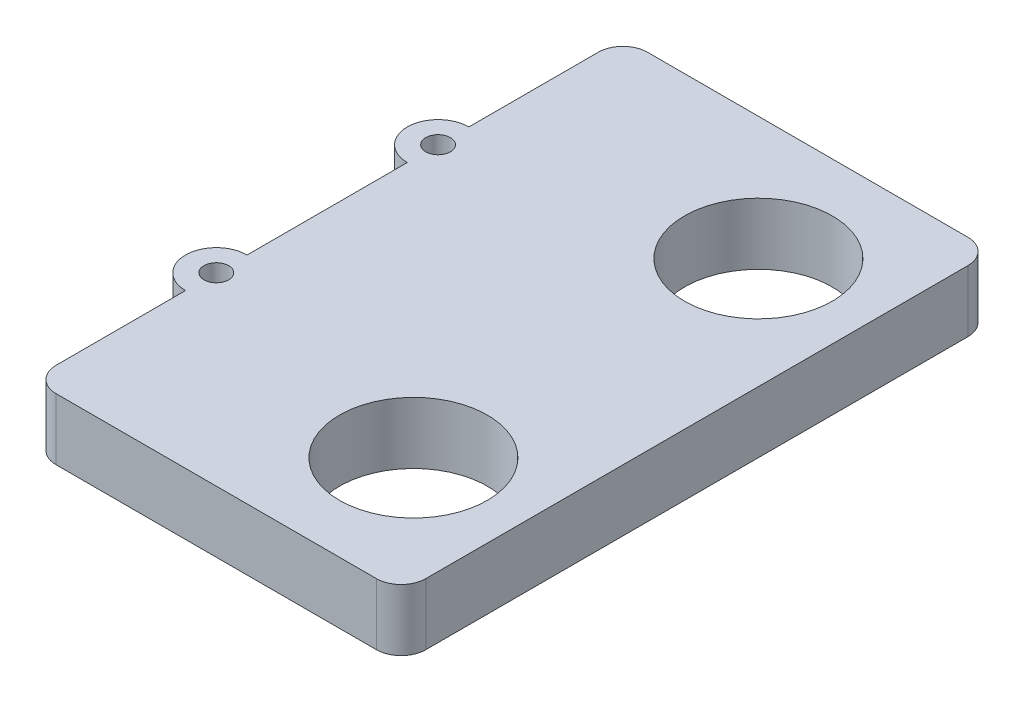
from build123d import *

# Parameters (mm, degrees)
SKETCH1_R           = 6
SKETCH1_R_2         = 1
BOSS_EXTRUDE1_DEPTH = 5
FILLET2_R           = 2


with BuildPart() as part:
    # Sketch1 → Boss-Extrude1 (new body)
    with BuildSketch(Plane(origin=(0, 0, 0), x_dir=(1, 0, 0), z_dir=(0, 1, 0))):
        with BuildLine():
            Line((0, 0), (30, 0))
            Line((30, 0), (30, 48))
            Line((30, 48), (0, 48))
            Line((0, 48), (0, 35.5))
            ThreePointArc((0, 35.5), (-2.5, 33), (0, 30.5))
            Line((0, 30.5), (0, 17.5))
            ThreePointArc((0, 17.5), (-2.5, 15), (0, 12.5))
            Line((0, 12.5), (0, 0))
        make_face()
        with Locations(Location((21, 38, 0), (0, 0, 270))):
            Circle(SKETCH1_R, mode=Mode.SUBTRACT)
        with Locations(Location((21, 10, 0), (0, 0, 270))):
            Circle(SKETCH1_R, mode=Mode.SUBTRACT)
        with Locations(Location((0, 33, 0), (0, 0, 270))):
            Circle(SKETCH1_R_2, mode=Mode.SUBTRACT)
        with Locations(Location((0, 15, 0), (0, 0, 270))):
            Circle(SKETCH1_R_2, mode=Mode.SUBTRACT)
    extrude(amount=BOSS_EXTRUDE1_DEPTH)

    # Fillet2
    fillet2_edges = [part.edges().sort_by_distance(p)[0] for p in [
        (30, 2.5, 0),
        (0, 2.5, 0),
        (0, 2.5, -48),
        (30, 2.5, -48),
    ]]
    fillet(fillet2_edges, radius=FILLET2_R)


solid = part.part
